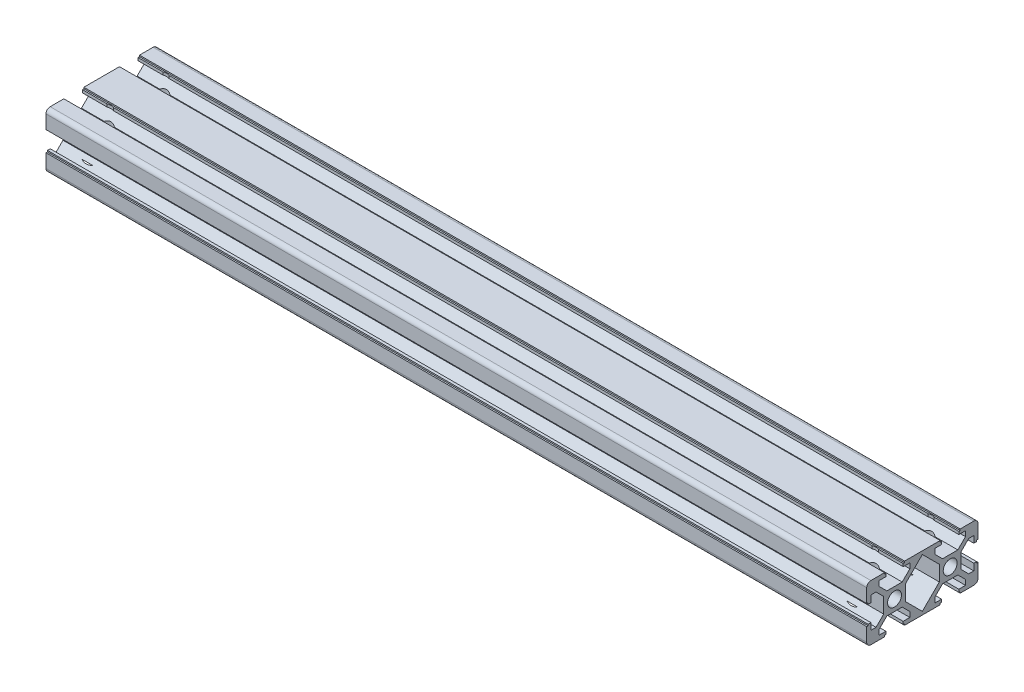
from build123d import *

# Parameters (mm, degrees)
SKETCH1_R                    = 2.5
F_20_X_40_X_R1_5_1_DEPTH     = 295
HOLE_WIZARD_M6_1_D           = 6.6
HOLE_WIZARD_M6_1_CBORE_D     = 11
HOLE_WIZARD_M6_1_CBORE_DEPTH = 6


with BuildPart() as part:
    # Sketch1 → 铝型材 20 X 40 X R1.5(1) (new body)
    with BuildSketch(Plane.YZ):
        with BuildLine():
            Line((-3.6, 10), (-3.6, 9.5))
            Line((-3.6, 9.5), (-3.1, 9.5))
            Line((-3.1, 9.5), (-3.1, 8.5))
            Line((-3.1, 8.5), (-5.5, 8.5))
            Line((-5.5, 8.5), (-5.5, 6.65))
            Line((-5.5, 6.65), (-2.75, 3.9))
            Line((-2.75, 3.9), (2.75, 3.9))
            Line((2.75, 3.9), (5.5, 6.65))
            Line((5.5, 6.65), (5.5, 8.5))
            Line((5.5, 8.5), (3.1, 8.5))
            Line((3.1, 8.5), (3.1, 9.5))
            Line((3.1, 9.5), (3.6, 9.5))
            Line((3.6, 9.5), (3.6, 10))
            Line((3.6, 10), (8.5, 10))
            ThreePointArc((8.5, 10), (9.560660172, 9.560660172), (10, 8.5))
            Line((10, 8.5), (10, 3.6))
            Line((10, 3.6), (9.5, 3.6))
            Line((9.5, 3.6), (9.5, 3.1))
            Line((9.5, 3.1), (8.5, 3.1))
            Line((8.5, 3.1), (8.5, 5.5))
            Line((8.5, 5.5), (6.65, 5.5))
            Line((6.65, 5.5), (3.9, 2.75))
            Line((3.9, 2.75), (3.9, -2.75))
            Line((3.9, -2.75), (6.65, -5.5))
            Line((6.65, -5.5), (8.5, -5.5))
            Line((8.5, -5.5), (8.5, -3.1))
            Line((8.5, -3.1), (9.5, -3.1))
            Line((9.5, -3.1), (9.5, -3.6))
            Line((9.5, -3.6), (10, -3.6))
            Line((10, -3.6), (10, -16.4))
            Line((10, -16.4), (9.5, -16.4))
            Line((9.5, -16.4), (9.5, -16.9))
            Line((9.5, -16.9), (8.5, -16.9))
            Line((8.5, -16.9), (8.5, -14.5))
            Line((8.5, -14.5), (6.65, -14.5))
            Line((6.65, -14.5), (3.9, -17.25))
            Line((3.9, -17.25), (3.9, -22.75))
            Line((3.9, -22.75), (6.65, -25.5))
            Line((6.65, -25.5), (8.5, -25.5))
            Line((8.5, -25.5), (8.5, -23.1))
            Line((8.5, -23.1), (9.5, -23.1))
            Line((9.5, -23.1), (9.5, -23.6))
            Line((9.5, -23.6), (10, -23.6))
            Line((10, -23.6), (10, -28.5))
            ThreePointArc((10, -28.5), (9.560660172, -29.560660172), (8.5, -30))
            Line((8.5, -30), (3.6, -30))
            Line((3.6, -30), (3.6, -29.5))
            Line((3.6, -29.5), (3.1, -29.5))
            Line((3.1, -29.5), (3.1, -28.5))
            Line((3.1, -28.5), (5.5, -28.5))
            Line((5.5, -28.5), (5.5, -26.65))
            Line((5.5, -26.65), (2.75, -23.9))
            Line((2.75, -23.9), (-2.75, -23.9))
            Line((-2.75, -23.9), (-5.5, -26.65))
            Line((-5.5, -26.65), (-5.5, -28.5))
            Line((-5.5, -28.5), (-3.1, -28.5))
            Line((-3.1, -28.5), (-3.1, -29.5))
            Line((-3.1, -29.5), (-3.6, -29.5))
            Line((-3.6, -29.5), (-3.6, -30))
            Line((-3.6, -30), (-8.5, -30))
            ThreePointArc((-8.5, -30), (-9.560660172, -29.560660172), (-10, -28.5))
            Line((-10, -28.5), (-10, -23.6))
            Line((-10, -23.6), (-9.5, -23.6))
            Line((-9.5, -23.6), (-9.5, -23.1))
            Line((-9.5, -23.1), (-8.5, -23.1))
            Line((-8.5, -23.1), (-8.5, -25.5))
            Line((-8.5, -25.5), (-6.65, -25.5))
            Line((-6.65, -25.5), (-3.9, -22.75))
            Line((-3.9, -22.75), (-3.9, -17.25))
            Line((-3.9, -17.25), (-6.65, -14.5))
            Line((-6.65, -14.5), (-8.5, -14.5))
            Line((-8.5, -14.5), (-8.5, -16.9))
            Line((-8.5, -16.9), (-9.5, -16.9))
            Line((-9.5, -16.9), (-9.5, -16.4))
            Line((-9.5, -16.4), (-10, -16.4))
            Line((-10, -16.4), (-10, -3.6))
            Line((-10, -3.6), (-9.5, -3.6))
            Line((-9.5, -3.6), (-9.5, -3.1))
            Line((-9.5, -3.1), (-8.5, -3.1))
            Line((-8.5, -3.1), (-8.5, -5.5))
            Line((-8.5, -5.5), (-6.65, -5.5))
            Line((-6.65, -5.5), (-3.9, -2.75))
            Line((-3.9, -2.75), (-3.9, 2.75))
            Line((-3.9, 2.75), (-6.65, 5.5))
            Line((-6.65, 5.5), (-8.5, 5.5))
            Line((-8.5, 5.5), (-8.5, 3.1))
            Line((-8.5, 3.1), (-9.5, 3.1))
            Line((-9.5, 3.1), (-9.5, 3.6))
            Line((-9.5, 3.6), (-10, 3.6))
            Line((-10, 3.6), (-10, 8.5))
            ThreePointArc((-10, 8.5), (-9.560660172, 9.560660172), (-8.5, 10))
            Line((-8.5, 10), (-3.6, 10))
        make_face()
        Circle(SKETCH1_R, mode=Mode.SUBTRACT)
        with Locations((0, -20)):
            Circle(SKETCH1_R, mode=Mode.SUBTRACT)
        Polygon((8.85, -10), (2.75, -3.9), (-2.75, -3.9), (-8.85, -10), (-2.75, -16.1), (2.75, -16.1), align=None, mode=Mode.SUBTRACT)
    extrude(amount=F_20_X_40_X_R1_5_1_DEPTH)

    # M6 六角凹头盖的柱孔1 (through all)
    with Locations(Plane.XZ.offset(10)):
        with Locations((285, -20), (10, 0), (10, -20), (285, 0)):
            CounterBoreHole(HOLE_WIZARD_M6_1_D / 2, HOLE_WIZARD_M6_1_CBORE_D / 2, HOLE_WIZARD_M6_1_CBORE_DEPTH)


solid = part.part
